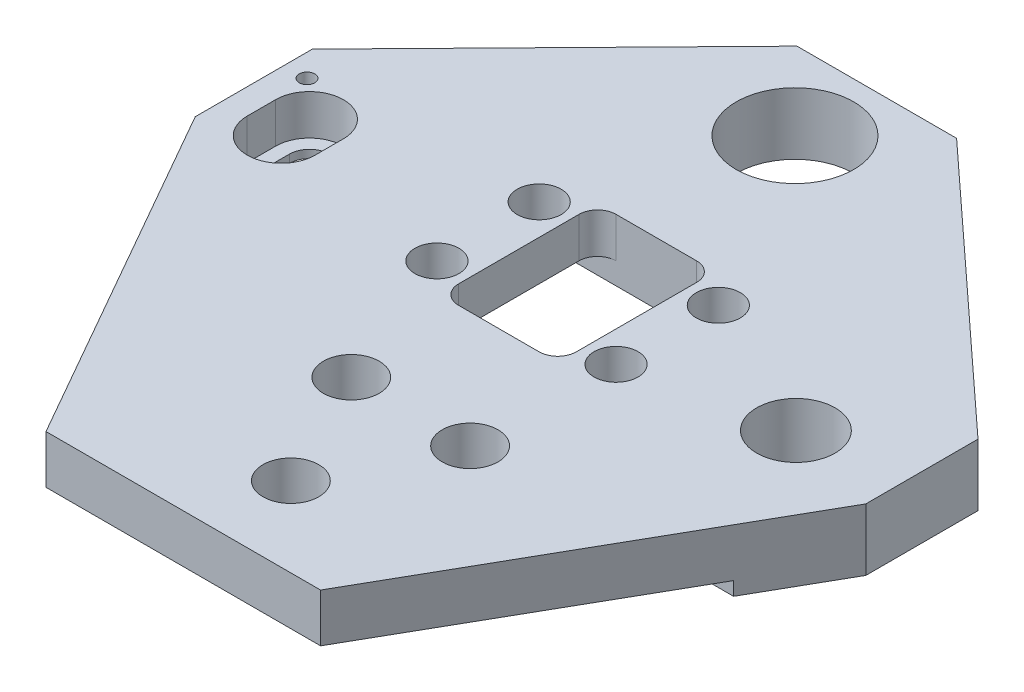
from build123d import *

# Parameters (mm, degrees)
SKETCH1_W           = 19
SKETCH1_H           = 25.42
BOSS_EXTRUDE2_DEPTH = 10
FILLET1_R           = 3
SKETCH3_W           = 19.1
SKETCH3_H           = 2.2
CUT_EXTRUDE2_DEPTH  = 127.977650002
SKETCH4_R           = 6.33
SKETCH4_R_2         = 3.55
SKETCH4_R_3         = 4.5
SKETCH4_R_4         = 9.475
SKETCH4_R_5         = 1.25
CUT_EXTRUDE3_DEPTH  = 81.239939075
SKETCH5_W           = 42.44
SKETCH5_H           = 2.2
CUT_EXTRUDE4_DEPTH  = 108.006765313
SKETCH6_W           = 39.39
SKETCH6_H           = 25.42
CUT_EXTRUDE5_DEPTH  = 3.5
FILLET2_R           = 2
CUT_EXTRUDE6_DEPTH  = 6.5
CUT_EXTRUDE7_DEPTH  = 80.879270294


with BuildPart() as part:
    # Sketch1 → Boss-Extrude2 (new body)
    with BuildSketch(Plane(origin=(0, 0, 0), x_dir=(1, 0, 0), z_dir=(0, 1, 0))):
        Polygon((54.1, 18.1), (54.1, 0), (22.15, -56.030772795), (-22.15, -56.030772795), (-54.1, 0), (-54.1, 18.89218031), (-15.415468147, 58.409227205), (10.334531853, 58.409227205), align=None)
        with Locations((0, 7.599227205)):
            Rectangle(SKETCH1_W, SKETCH1_H, mode=Mode.SUBTRACT)
    extrude(amount=BOSS_EXTRUDE2_DEPTH)

    # Fillet1
    fillet1_edges = [part.edges().sort_by_distance(p)[0] for p in [
        (-9.5, 5, 5.110772795),
        (9.5, 5, 5.110772795),
        (9.5, 5, -20.309227205),
        (-9.5, 5, -20.309227205),
    ]]
    fillet(fillet1_edges, radius=FILLET1_R)

    # Sketch3 → Cut-Extrude2 (cut, through all)
    with BuildSketch(Plane(origin=(0, 0, -58.409227205), x_dir=(-1, 0, 0), z_dir=(0, 0, -1))):
        with Locations((44.55, 1.1)):
            Rectangle(SKETCH3_W, SKETCH3_H)
    extrude(amount=-CUT_EXTRUDE2_DEPTH, mode=Mode.SUBTRACT)

    # Sketch4 → Cut-Extrude3 (cut, through all)
    with BuildSketch(Plane(origin=(0, 10, 0), x_dir=(1, 0, 0), z_dir=(0, 1, 0))):
        with Locations((38.2, 4.619227205)):
            Circle(SKETCH4_R)
        with Locations((-14.45, -0.650772795)):
            Circle(SKETCH4_R_2)
        with Locations((-14.45, 15.849227205)):
            Circle(SKETCH4_R_2)
        with Locations((14.45, -0.650772795)):
            Circle(SKETCH4_R_2)
        with Locations((14.45, 15.849227205)):
            Circle(SKETCH4_R_2)
        with Locations((-5.105, -23.816239571)):
            Circle(SKETCH4_R_3)
        with Locations((14.065, -23.816239571)):
            Circle(SKETCH4_R_3)
        with Locations((4.48, -43.150772795)):
            Circle(SKETCH4_R_3)
        with Locations((-3.065, 45.734227205)):
            Circle(SKETCH4_R_4)
        with Locations((-50.45, 14.379227205)):
            Circle(SKETCH4_R_5)
    extrude(amount=-CUT_EXTRUDE3_DEPTH, mode=Mode.SUBTRACT)

    # Sketch5 → Cut-Extrude4 (cut, through all)
    with BuildSketch(Plane.ZY.offset(35)):
        with Locations((34.810772795, 1.1)):
            Rectangle(SKETCH5_W, SKETCH5_H)
    extrude(amount=-CUT_EXTRUDE4_DEPTH, mode=Mode.SUBTRACT)

    # Sketch6 → Cut-Extrude5 (cut)
    with BuildSketch(Plane.XZ):
        with Locations((0, -7.599227205)):
            Rectangle(SKETCH6_W, SKETCH6_H)
    extrude(amount=-CUT_EXTRUDE5_DEPTH, mode=Mode.SUBTRACT)

    # Fillet2
    fillet2_edges = [part.edges().sort_by_distance(p)[0] for p in [
        (19.695, 1.75, 5.110772795),
        (19.695, 1.75, -20.309227205),
        (-19.695, 1.75, 5.110772795),
        (-19.695, 1.75, -20.309227205),
    ]]
    fillet(fillet2_edges, radius=FILLET2_R)

    # Sketch4<3> → Cut-Extrude6 (cut)
    with BuildSketch(Plane(origin=(0, 10, 0), x_dir=(1, 0, 0), z_dir=(0, 1, 0))):
        with BuildLine():
            Line((-39.06, 4.289227205), (-39.06, 8.869227205))
            ThreePointArc((-39.06, 8.869227205), (-44.53, 14.339227205), (-50, 8.869227205))
            Line((-50, 8.869227205), (-50, 4.289227205))
            ThreePointArc((-50, 4.289227205), (-44.53, -1.180772795), (-39.06, 4.289227205))
        make_face()
    extrude(amount=-CUT_EXTRUDE6_DEPTH, mode=Mode.SUBTRACT)

    # Sketch7 → Cut-Extrude7 (cut, through all)
    with BuildSketch(Plane(origin=(0, 3.5, 0), x_dir=(-1, 0, 0), z_dir=(0, 1, 0))):
        with BuildLine():
            Line((41.28, -8.869227205), (41.28, -4.289227205))
            ThreePointArc((41.28, -4.289227205), (44.53, -1.039227205), (47.78, -4.289227205))
            Line((47.78, -4.289227205), (47.78, -8.869227205))
            ThreePointArc((47.78, -8.869227205), (44.53, -12.119227205), (41.28, -8.869227205))
        make_face()
    extrude(amount=-CUT_EXTRUDE7_DEPTH, mode=Mode.SUBTRACT)


solid = part.part
